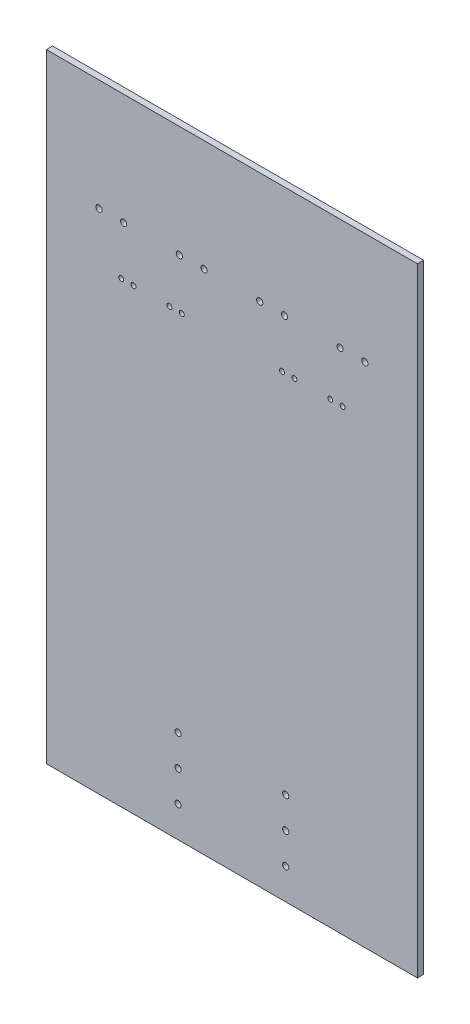
from build123d import *

# Parameters (mm, degrees)
SKETCH1_W           = 300
SKETCH1_H           = 500
BOSS_EXTRUDE1_DEPTH = 5
SKETCH2_R           = 2.5
SKETCH2_R_2         = 2
CUT_EXTRUDE1_DEPTH  = 10
SKETCH3_R           = 2.5
CUT_EXTRUDE2_DEPTH  = 10


with BuildPart() as part:
    # Sketch1 → Boss-Extrude1 (new body)
    with BuildSketch(Plane.XY):
        with Locations((150, 250)):
            Rectangle(SKETCH1_W, SKETCH1_H)
    extrude(amount=BOSS_EXTRUDE1_DEPTH)

    # Sketch2 → Cut-Extrude1 (cut)
    with BuildSketch(Plane.XY.offset(5)):
        with Locations((42.5, 410)):
            Circle(SKETCH2_R)
        with Locations((62.5, 410)):
            Circle(SKETCH2_R)
        with Locations((107.5, 410)):
            Circle(SKETCH2_R)
        with Locations((127.5, 410)):
            Circle(SKETCH2_R)
        with Locations((172.5, 410)):
            Circle(SKETCH2_R)
        with Locations((192.5, 410)):
            Circle(SKETCH2_R)
        with Locations((237.5, 410)):
            Circle(SKETCH2_R)
        with Locations((70.5, 370)):
            Circle(SKETCH2_R_2)
        with Locations((99.5, 370)):
            Circle(SKETCH2_R_2)
        with Locations((200.5, 370)):
            Circle(SKETCH2_R_2)
        with Locations((257.5, 410)):
            Circle(SKETCH2_R)
        with Locations((229.5, 370)):
            Circle(SKETCH2_R_2)
        with Locations((60.5, 370)):
            Circle(SKETCH2_R_2)
        with Locations((109.5, 370)):
            Circle(SKETCH2_R_2)
        with Locations((190.5, 370)):
            Circle(SKETCH2_R_2)
        with Locations((239.5, 370)):
            Circle(SKETCH2_R_2)
    extrude(amount=-CUT_EXTRUDE1_DEPTH, mode=Mode.SUBTRACT)

    # Sketch3 → Cut-Extrude2 (cut)
    with BuildSketch(Plane.XY.offset(5)):
        with Locations((106.5, 25)):
            Circle(SKETCH3_R)
        with Locations((106.5, 50)):
            Circle(SKETCH3_R)
        with Locations((106.5, 75)):
            Circle(SKETCH3_R)
        with Locations((193.5, 25)):
            Circle(SKETCH3_R)
        with Locations((193.5, 50)):
            Circle(SKETCH3_R)
        with Locations((193.5, 75)):
            Circle(SKETCH3_R)
    extrude(amount=-CUT_EXTRUDE2_DEPTH, mode=Mode.SUBTRACT)


solid = part.part
